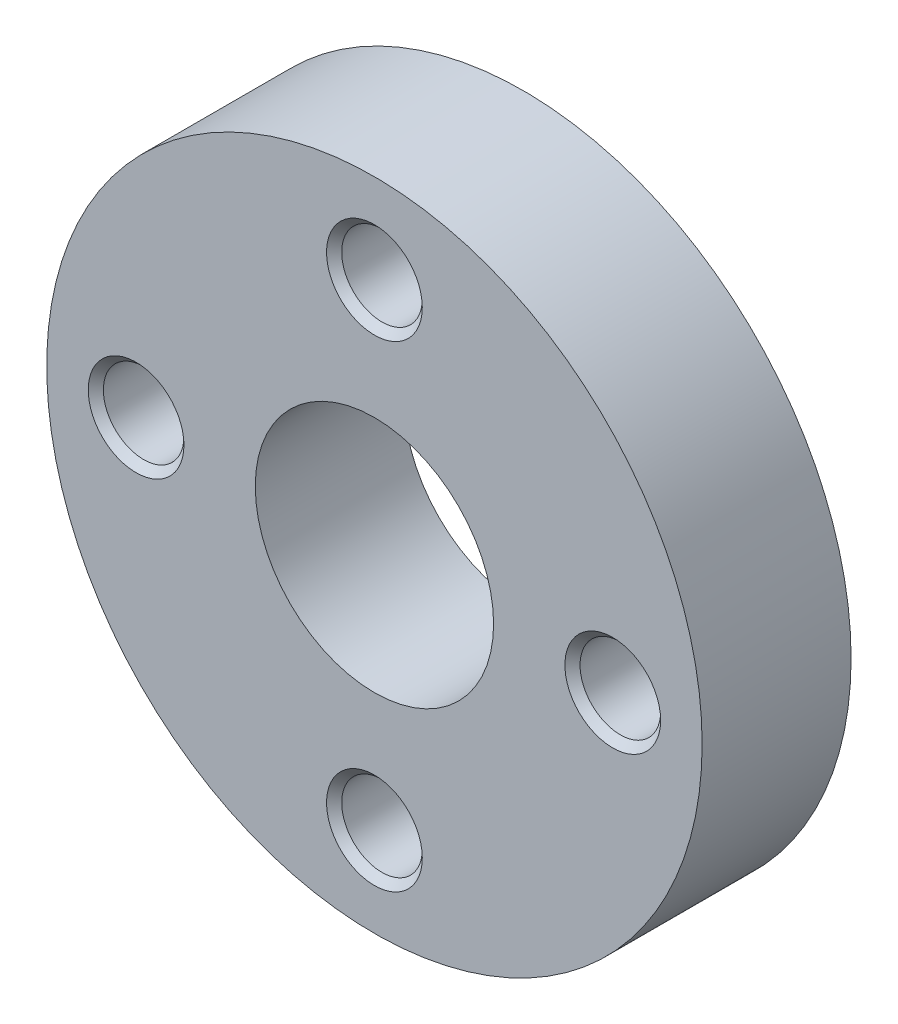
from build123d import *

# Parameters (mm, degrees)
SKETCH1_R             = 11
EXTRUDE1_DEPTH        = 5
F_6_32_TAPPED_HOLE3_D = 2.7051
CHAMFER1_SIZE         = 0.254
SKETCH2_R             = 4
EXTRUDE2_DEPTH        = 17.340134638


with BuildPart() as part:
    # Sketch1 → Extrude1 (new body)
    with BuildSketch(Plane.XY):
        Circle(SKETCH1_R)
    extrude(amount=-EXTRUDE1_DEPTH)

    # #6-32 Tapped Hole3 (through all)
    with Locations(Plane(origin=(0, 8, 0), x_dir=(1, 0, 0), z_dir=(0, 0, 1))):
        with Locations((0, 0), (-8, -8), (8, -8), (0, -16)):
            Hole(F_6_32_TAPPED_HOLE3_D / 2)

    # Chamfer1
    chamfer1_edges = [part.edges().sort_by_distance(p)[0] for p in [
        (9.35255, 0, 0),
        (9.35255, 0, -5),
        (-6.64745, 0, 0),
        (-6.64745, 0, -5),
        (1.35255, 8, 0),
        (1.35255, 8, -5),
        (1.35255, -8, 0),
        (1.35255, -8, -5),
    ]]
    chamfer(chamfer1_edges, length=CHAMFER1_SIZE)

    # Sketch2 → Extrude2 (cut, through all)
    with BuildSketch(Plane.XY):
        Circle(SKETCH2_R)
    extrude(amount=-EXTRUDE2_DEPTH, mode=Mode.SUBTRACT)


solid = part.part
